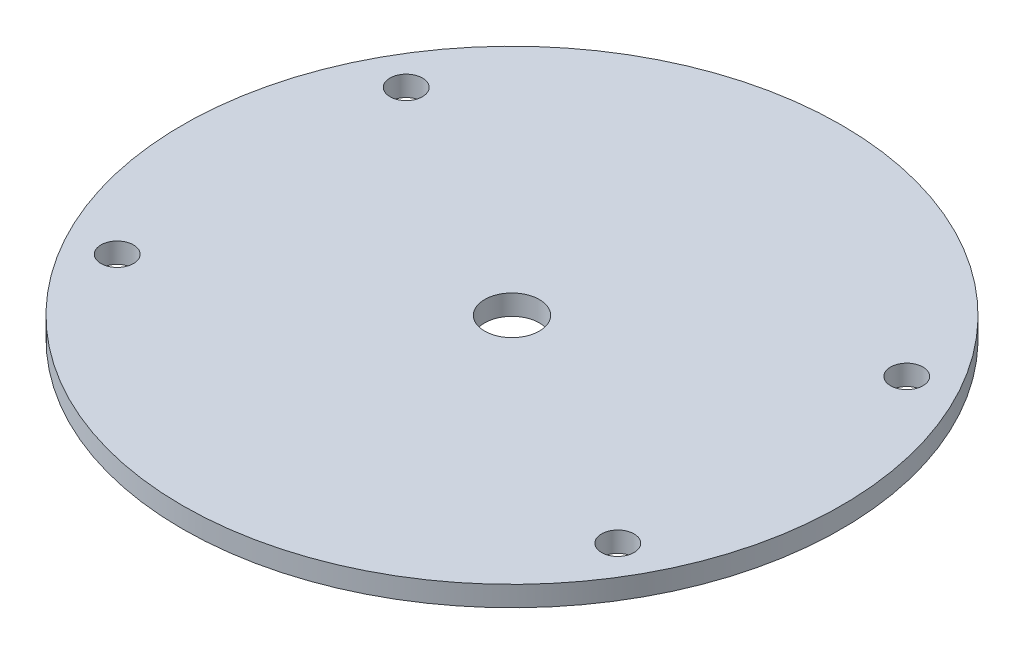
from build123d import *

# Parameters (mm, degrees)
SKETCH_1_R      = 32.5
SKETCH_1_R_2    = 1.6
SKETCH_1_R_3    = 2.7
EXTRUDE_1_DEPTH = 2


with BuildPart() as part:
    # 草图1 → 凸台-拉伸1 (new body)
    with BuildSketch(Plane(origin=(0, 0, 0), x_dir=(1, 0, 0), z_dir=(0, 1, 0))):
        with Locations(Location((0, 0, 0), (0, 0, 270))):
            Circle(SKETCH_1_R)
        with Locations(Location((24.681724008, -14.25, 0), (0, 0, 270))):
            Circle(SKETCH_1_R_2, mode=Mode.SUBTRACT)
        with Locations(Location((-24.681724008, -14.25, 0), (0, 0, 90))):
            Circle(SKETCH_1_R_2, mode=Mode.SUBTRACT)
        with Locations(Location((24.681724008, 14.25, 0), (0, 0, 90))):
            Circle(SKETCH_1_R_2, mode=Mode.SUBTRACT)
        with Locations(Location((-24.681724008, 14.25, 0), (0, 0, 270))):
            Circle(SKETCH_1_R_2, mode=Mode.SUBTRACT)
        with Locations(Location((0, 0, 0), (0, 0, 270))):
            Circle(SKETCH_1_R_3, mode=Mode.SUBTRACT)
    extrude(amount=EXTRUDE_1_DEPTH)


solid = part.part
